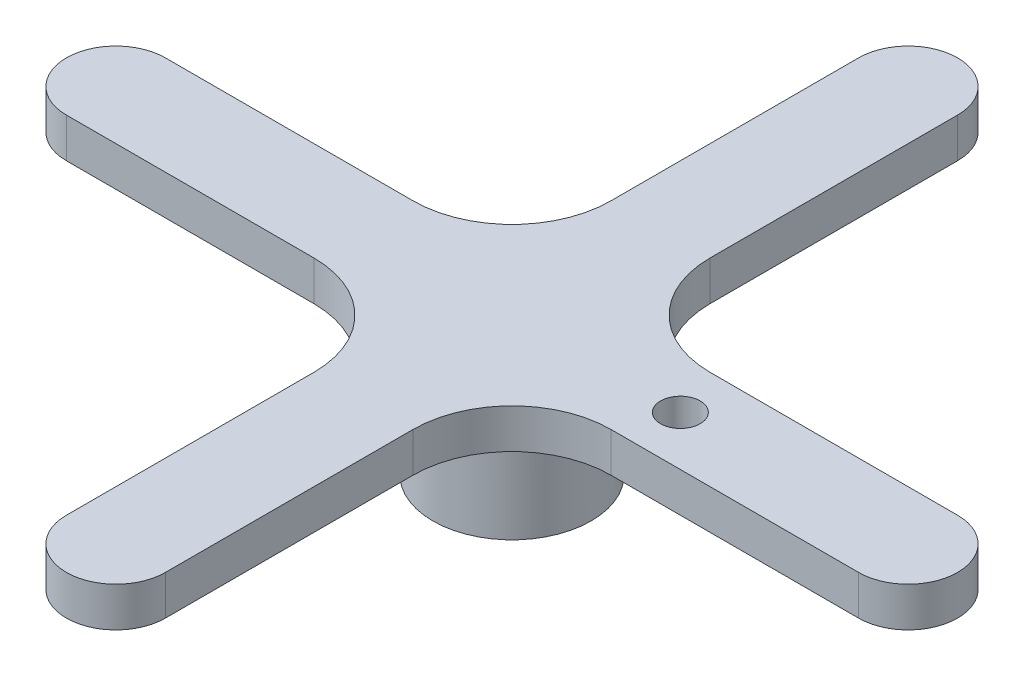
from build123d import *

# Parameters (mm, degrees)
SKETCH1_R           = 1
BOSS_EXTRUDE1_DEPTH = 2
SKETCH2_R           = 4
SKETCH2_R_2         = 2.95
BOSS_EXTRUDE2_DEPTH = 5


with BuildPart() as part:
    # Sketch1 → Boss-Extrude1 (new body)
    with BuildSketch(Plane(origin=(0, 0, 0), x_dir=(1, 0, 0), z_dir=(0, 1, 0))):
        with BuildLine():
            Line((2.5, 20), (2.5, 7.5))
            ThreePointArc((2.5, 7.5), (3.964466094, 3.964466094), (7.5, 2.5))
            Line((7.5, 2.5), (20, 2.5))
            ThreePointArc((20, 2.5), (22.5, 0), (20, -2.5))
            Line((20, -2.5), (7.5, -2.5))
            ThreePointArc((7.5, -2.5), (3.964466094, -3.964466094), (2.5, -7.5))
            Line((2.5, -7.5), (2.5, -20))
            ThreePointArc((2.5, -20), (0, -22.5), (-2.5, -20))
            Line((-2.5, -20), (-2.5, -7.5))
            ThreePointArc((-2.5, -7.5), (-3.964466094, -3.964466094), (-7.5, -2.5))
            Line((-7.5, -2.5), (-20, -2.5))
            ThreePointArc((-20, -2.5), (-22.5, 0), (-20, 2.5))
            Line((-20, 2.5), (-7.5, 2.5))
            ThreePointArc((-7.5, 2.5), (-3.964466094, 3.964466094), (-2.5, 7.5))
            Line((-2.5, 7.5), (-2.5, 20))
            ThreePointArc((-2.5, 20), (0, 22.5), (2.5, 20))
        make_face()
        with Locations(Location((8.5, 0, 0), (0, 0, 270))):
            Circle(SKETCH1_R, mode=Mode.SUBTRACT)
    extrude(amount=BOSS_EXTRUDE1_DEPTH)

    # Sketch2 → Boss-Extrude2 (add)
    with BuildSketch(Plane.XZ):
        with Locations(Location((0, 0, 0), (0, 0, 90))):
            Circle(SKETCH2_R)
        with Locations(Location((0, 0, 0), (0, 0, 270))):
            Circle(SKETCH2_R_2, mode=Mode.SUBTRACT)
    extrude(amount=BOSS_EXTRUDE2_DEPTH)


solid = part.part
